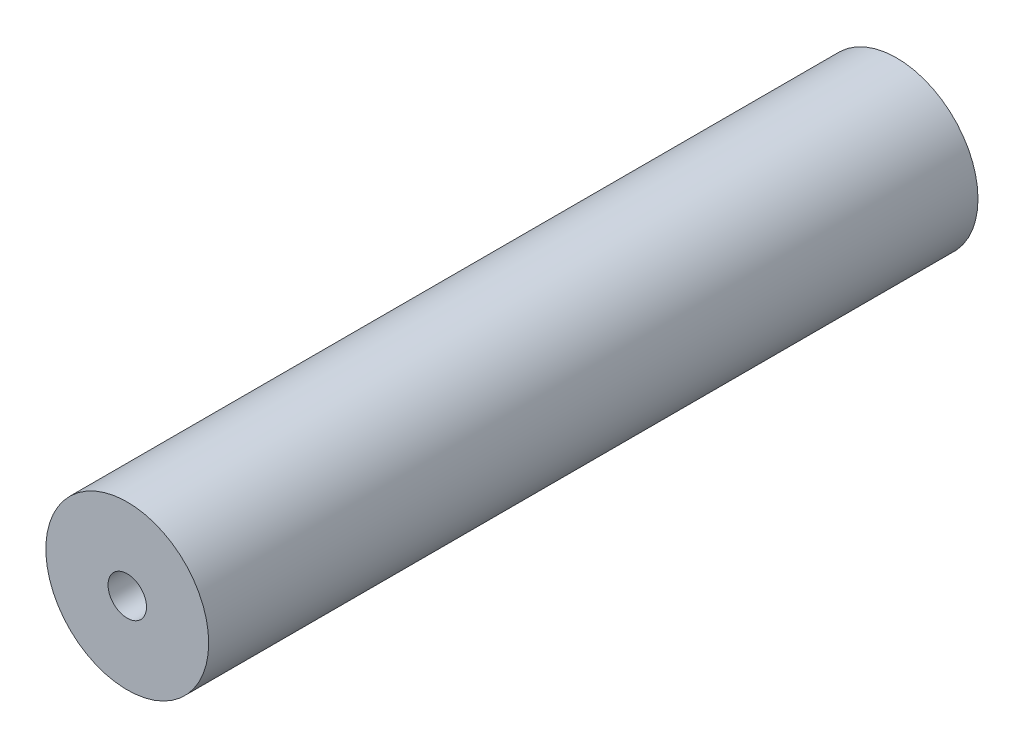
from build123d import *

# Parameters (mm, degrees)
SKETCH1_R           = 3.175
SKETCH1_R_2         = 0.75
BOSS_EXTRUDE1_DEPTH = 30


with BuildPart() as part:
    # Sketch1 → Boss-Extrude1 (new body)
    with BuildSketch(Plane.XY):
        Circle(SKETCH1_R)
        Circle(SKETCH1_R_2, mode=Mode.SUBTRACT)
    extrude(amount=BOSS_EXTRUDE1_DEPTH)


solid = part.part
